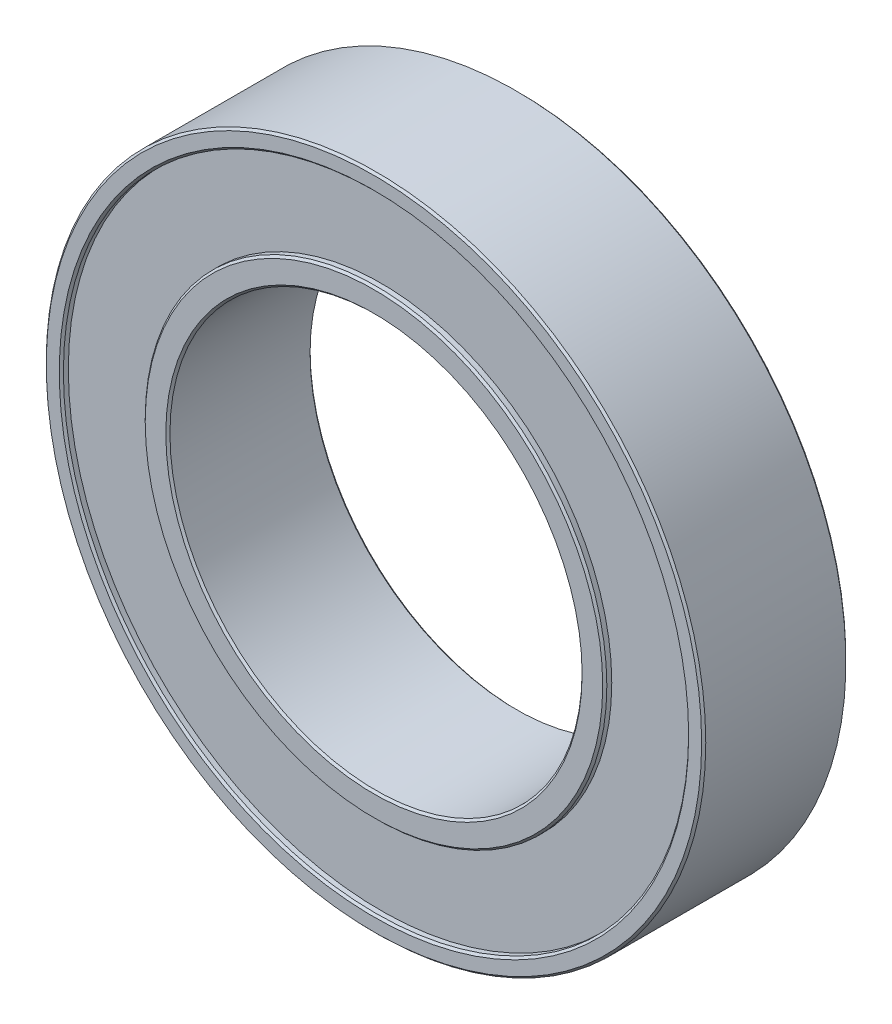
from build123d import *

# Parameters (mm, degrees)
CHAMFER1_SIZE = 0.1


with BuildPart() as part:
    # Sketch1 → Revolve1 (revolve)
    with BuildSketch(Plane(origin=(0, 0, 0), x_dir=(0, 0, -1), z_dir=(1, 0, 0)), mode=Mode.PRIVATE) as revolve1_sk:
        Polygon((-3.5, 16), (3.5, 16), (3.5, 15.169361198), (3.160325371, 15.169361198), (3.160325371, 11.199592719), (3.5, 11.199592719), (3.5, 10), (-3.5, 10), (-3.5, 11.199592719), (-3.160325371, 11.199592719), (-3.160325371, 15.169361198), (-3.5, 15.169361198), align=None)
    revolve(revolve1_sk.sketch.rotate(Axis((0, 0, -19.078271996), (0, 0, 1)), 90), axis=Axis((0, 0, -19.078271996), (0, 0, 1)))

    # Chamfer1
    chamfer1_edges = [part.edges().sort_by_distance(p)[0] for p in [
        (15.169361198, 0, 3.5),
        (16, 0, 3.5),
        (16, 0, -3.5),
        (15.169361198, 0, -3.5),
        (11.199592719, 0, -3.5),
        (10, 0, -3.5),
        (10, 0, 3.5),
        (11.199592719, 0, 3.5),
    ]]
    chamfer(chamfer1_edges, length=CHAMFER1_SIZE)


solid = part.part
